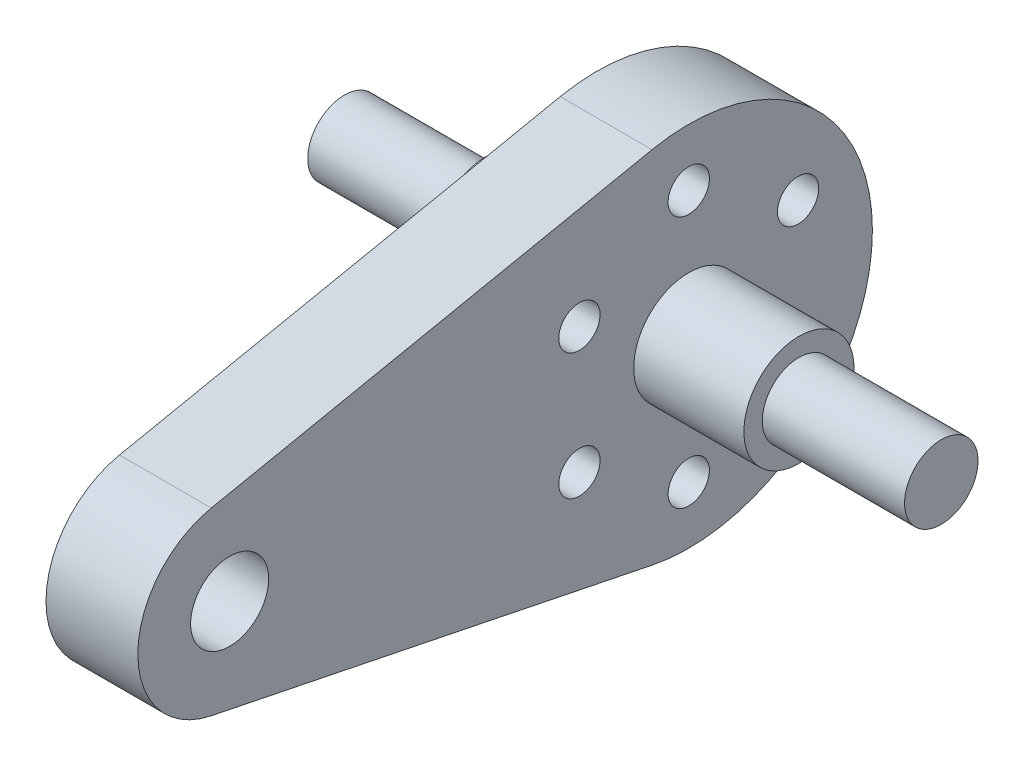
from build123d import *

# Parameters (mm, degrees)
CROQUIS2_R              = 4.25
SALIENTE_EXTRUIR1_DEPTH = 5
CORTAR_EXTRUIR1_REACH   = 75.527
CROQUIS3_R              = 2.25


with BuildPart() as part:
    # Croquis1 → Revolución1 (revolve)
    with BuildSketch(Plane.XY, mode=Mode.PRIVATE) as revoluci_n1_sk:
        Polygon((32.5, 0), (-32.5, 0), (-32.5, 4), (-17, 4), (-17, 6), (-5, 6), (-5, 20), (5, 20), (5, 6), (17, 6), (17, 4), (32.5, 4), align=None)
    revolve(revoluci_n1_sk.sketch.rotate(Axis((32.5, 0, 0), (-1, 0, 0)), 90), axis=Axis((32.5, 0, 0), (-1, 0, 0)))

    # Croquis2 → Saliente-Extruir1 (add, symmetric)
    with BuildSketch(Plane(origin=(0, 0, 0), x_dir=(0, 0, -1), z_dir=(1, 0, 0))):
        with BuildLine():
            Line((-52, 9.797958971), (-4, 19.595917942))
            ThreePointArc((-4, 19.595917942), (20, 0), (-4, -19.595917942))
            Line((-4, -19.595917942), (-52, -9.797958971))
            ThreePointArc((-52, -9.797958971), (-60, 0), (-52, 9.797958971))
        make_face()
        with Locations((-50, 0)):
            Circle(CROQUIS2_R, mode=Mode.SUBTRACT)
    extrude(amount=SALIENTE_EXTRUIR1_DEPTH, both=True)

    # Croquis3 → Cortar-Extruir1 (cut, up to next)
    with BuildSketch(Plane(origin=(5, 0, 0), x_dir=(0, 0, -1), z_dir=(1, 0, 0)), mode=Mode.PRIVATE) as cortar_extruir1_sk1:
        with Locations((0, 13.75)):
            Circle(CROQUIS3_R)
    cortar_extruir1_tool1 = extrude(cortar_extruir1_sk1.sketch, amount=-CORTAR_EXTRUIR1_REACH, mode=Mode.PRIVATE) & part.part
    # Croquis3 → Cortar-Extruir1 (cut, up to next)
    with BuildSketch(Plane(origin=(5, 0, 0), x_dir=(0, 0, -1), z_dir=(1, 0, 0)), mode=Mode.PRIVATE) as cortar_extruir1_sk2:
        with Locations((11.907849302, 6.875)):
            Circle(CROQUIS3_R)
    cortar_extruir1_tool2 = extrude(cortar_extruir1_sk2.sketch, amount=-CORTAR_EXTRUIR1_REACH, mode=Mode.PRIVATE) & part.part
    # Croquis3 → Cortar-Extruir1 (cut, up to next)
    with BuildSketch(Plane(origin=(5, 0, 0), x_dir=(0, 0, -1), z_dir=(1, 0, 0)), mode=Mode.PRIVATE) as cortar_extruir1_sk3:
        with Locations((11.907849302, -6.875)):
            Circle(CROQUIS3_R)
    cortar_extruir1_tool3 = extrude(cortar_extruir1_sk3.sketch, amount=-CORTAR_EXTRUIR1_REACH, mode=Mode.PRIVATE) & part.part
    # Croquis3 → Cortar-Extruir1 (cut, up to next)
    with BuildSketch(Plane(origin=(5, 0, 0), x_dir=(0, 0, -1), z_dir=(1, 0, 0)), mode=Mode.PRIVATE) as cortar_extruir1_sk4:
        with Locations((0, -13.75)):
            Circle(CROQUIS3_R)
    cortar_extruir1_tool4 = extrude(cortar_extruir1_sk4.sketch, amount=-CORTAR_EXTRUIR1_REACH, mode=Mode.PRIVATE) & part.part
    # Croquis3 → Cortar-Extruir1 (cut, up to next)
    with BuildSketch(Plane(origin=(5, 0, 0), x_dir=(0, 0, -1), z_dir=(1, 0, 0)), mode=Mode.PRIVATE) as cortar_extruir1_sk5:
        with Locations((-11.907849302, -6.875)):
            Circle(CROQUIS3_R)
    cortar_extruir1_tool5 = extrude(cortar_extruir1_sk5.sketch, amount=-CORTAR_EXTRUIR1_REACH, mode=Mode.PRIVATE) & part.part
    # Croquis3 → Cortar-Extruir1 (cut, up to next)
    with BuildSketch(Plane(origin=(5, 0, 0), x_dir=(0, 0, -1), z_dir=(1, 0, 0)), mode=Mode.PRIVATE) as cortar_extruir1_sk6:
        with Locations((-11.907849302, 6.875)):
            Circle(CROQUIS3_R)
    cortar_extruir1_tool6 = extrude(cortar_extruir1_sk6.sketch, amount=-CORTAR_EXTRUIR1_REACH, mode=Mode.PRIVATE) & part.part
    add(cortar_extruir1_tool1.solids().sort_by_distance((5, 13.75, 0))[0], mode=Mode.SUBTRACT)
    add(cortar_extruir1_tool2.solids().sort_by_distance((5, 6.875, -11.907849))[0], mode=Mode.SUBTRACT)
    add(cortar_extruir1_tool3.solids().sort_by_distance((5, -6.875, -11.907849))[0], mode=Mode.SUBTRACT)
    add(cortar_extruir1_tool4.solids().sort_by_distance((5, -13.75, 0))[0], mode=Mode.SUBTRACT)
    add(cortar_extruir1_tool5.solids().sort_by_distance((5, -6.875, 11.907849))[0], mode=Mode.SUBTRACT)
    add(cortar_extruir1_tool6.solids().sort_by_distance((5, 6.875, 11.907849))[0], mode=Mode.SUBTRACT)


solid = part.part
